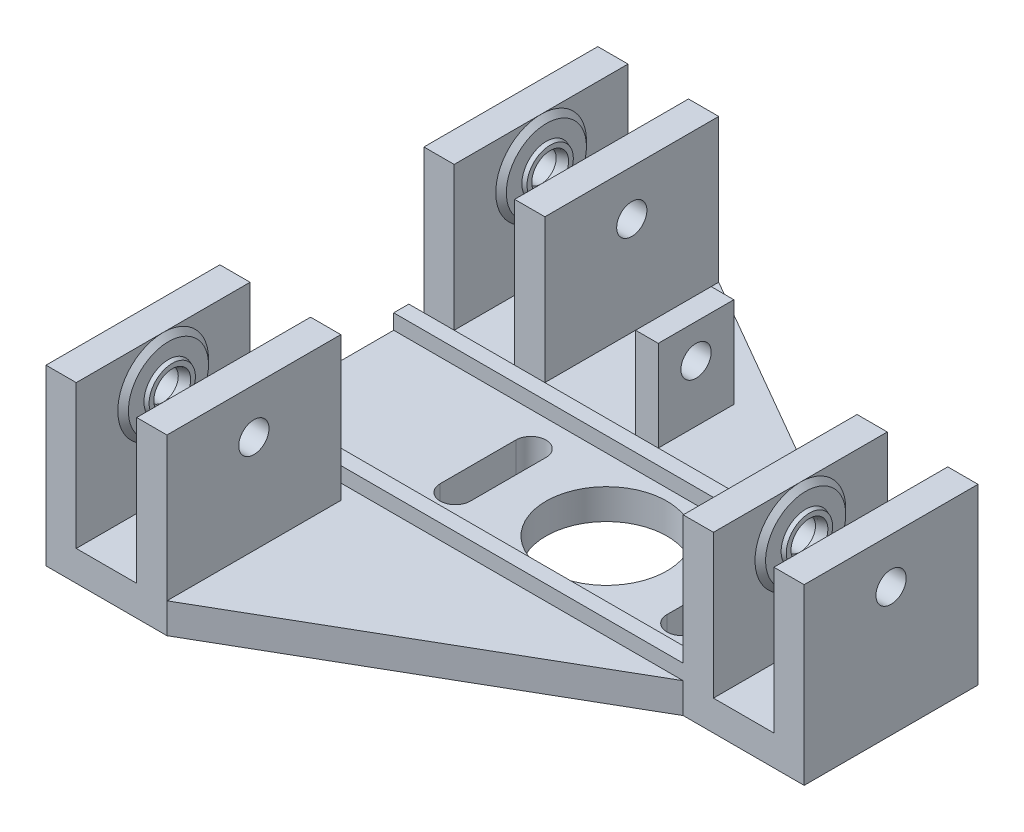
from build123d import *

# Parameters (mm, degrees)
SKETCH1_R                     = 8
BOSS_EXTRUDE1_DEPTH           = 4
SKETCH2_W                     = 4
SKETCH2_H                     = 23
BOSS_EXTRUDE2_DEPTH           = 19
SKETCH3_R                     = 2
CUT_EXTRUDE1_DEPTH            = 87.784395441
SKETCH4_R                     = 6
SKETCH4_R_2                   = 2
BOSS_EXTRUDE3_DEPTH           = 0.7
BOSS_EXTRUDE3_DRAFT           = 45
BOSS_EXTRUDE3_PROFILE_2_DEPTH = 0.7
BOSS_EXTRUDE3_PROFILE_2_DRAFT = 45
SKETCH5_R                     = 3.5
SKETCH5_R_2                   = 2
BOSS_EXTRUDE4_DEPTH           = 1.2
BOSS_EXTRUDE4_DRAFT           = 20
BOSS_EXTRUDE4_PROFILE_2_DEPTH = 1.2
BOSS_EXTRUDE4_PROFILE_2_DRAFT = 20
SKETCH6_R                     = 6
SKETCH6_R_2                   = 2
BOSS_EXTRUDE5_DEPTH           = 0.7
BOSS_EXTRUDE5_DRAFT           = 45
BOSS_EXTRUDE5_PROFILE_2_DEPTH = 0.7
BOSS_EXTRUDE5_PROFILE_2_DRAFT = 45
SKETCH7_R                     = 3.5
SKETCH7_R_2                   = 2
BOSS_EXTRUDE6_DEPTH           = 1.2
BOSS_EXTRUDE6_DRAFT           = 20
BOSS_EXTRUDE6_PROFILE_2_DEPTH = 1.2
BOSS_EXTRUDE6_PROFILE_2_DRAFT = 20
SKETCH8_R                     = 6
SKETCH8_R_2                   = 2
BOSS_EXTRUDE7_DEPTH           = 0.7
BOSS_EXTRUDE7_DRAFT           = 45
SKETCH9_R                     = 3.5
SKETCH9_R_2                   = 2
BOSS_EXTRUDE8_DEPTH           = 1.2
BOSS_EXTRUDE8_DRAFT           = 20
SKETCH11_R                    = 6
SKETCH11_R_2                  = 2
BOSS_EXTRUDE9_DEPTH           = 0.7
BOSS_EXTRUDE9_DRAFT           = 45
SKETCH12_R                    = 3.5
SKETCH12_R_2                  = 2
BOSS_EXTRUDE10_DEPTH          = 1.2
BOSS_EXTRUDE10_DRAFT          = 20
SKETCH13_W                    = 59.30127019
SKETCH13_H                    = 2
BOSS_EXTRUDE11_DEPTH          = 2
SKETCH14_W                    = 3
SKETCH14_H                    = 10
BOSS_EXTRUDE12_DEPTH          = 12
CUT_EXTRUDE2_REACH            = 63.837
SKETCH15_R                    = 2


with BuildPart() as part:
    # Sketch1 → Boss-Extrude1 (new body)
    with BuildSketch(Plane(origin=(0, 0, 0), x_dir=(1, 0, 0), z_dir=(0, 1, 0))):
        Polygon((-21.650635095, 36.5), (-37.650635095, 36.5), (-37.650635095, -36.5), (-21.650635095, -36.5), (21.650635095, -11.5), (37.650635095, -11.5), (37.650635095, 11.5), (21.650635095, 11.5), align=None)
        with BuildLine():
            ThreePointArc((-13, -5), (-15, -7), (-17, -5))
            Line((-17, -5), (-17, 5))
            ThreePointArc((-17, 5), (-15, 7), (-13, 5))
            Line((-13, 5), (-13, -5))
        make_face(mode=Mode.SUBTRACT)
        with Locations(Location((0, 0, 0), (0, 0, 270))):
            Circle(SKETCH1_R, mode=Mode.SUBTRACT)
        with BuildLine():
            ThreePointArc((17, -5), (15, -7), (13, -5))
            Line((13, -5), (13, 5))
            ThreePointArc((13, 5), (15, 7), (17, 5))
            Line((17, 5), (17, -5))
        make_face(mode=Mode.SUBTRACT)
    extrude(amount=BOSS_EXTRUDE1_DEPTH)

    # Sketch2 → Boss-Extrude2 (add)
    with BuildSketch(Plane(origin=(0, 4, 0), x_dir=(1, 0, 0), z_dir=(0, 1, 0))):
        with Locations((35.650635095, 0)):
            Rectangle(SKETCH2_W, SKETCH2_H)
        with Locations((23.650635095, 0)):
            Rectangle(SKETCH2_W, SKETCH2_H)
        with Locations((-35.650635095, 25)):
            Rectangle(SKETCH2_W, SKETCH2_H)
        with Locations((-23.650635095, 25)):
            Rectangle(SKETCH2_W, SKETCH2_H)
        with Locations((-35.650635095, -25)):
            Rectangle(SKETCH2_W, SKETCH2_H)
        with Locations((-23.650635095, -25)):
            Rectangle(SKETCH2_W, SKETCH2_H)
    extrude(amount=BOSS_EXTRUDE2_DEPTH)

    # Sketch3 → Cut-Extrude1 (cut, through all)
    with BuildSketch(Plane.ZY.offset(37.650635095)):
        with Locations((-25, 17)):
            Circle(SKETCH3_R)
        with Locations((0, 17)):
            Circle(SKETCH3_R)
        with Locations((25, 17)):
            Circle(SKETCH3_R)
    extrude(amount=-CUT_EXTRUDE1_DEPTH, mode=Mode.SUBTRACT)


with BuildPart() as boss_extrude3_tool:
    # Sketch4 → Boss-Extrude3 (with draft: the straight prism first)
    with BuildSketch(Plane.ZY.offset(25.650635095)):
        with Locations((-25, 17)):
            Circle(SKETCH4_R)
        with Locations((-25, 17)):
            Circle(SKETCH4_R_2, mode=Mode.SUBTRACT)
    extrude(amount=BOSS_EXTRUDE3_DEPTH)
    # Boss-Extrude3: the draft: its side faces are tilted about the plane it starts from
    boss_extrude3_sides = [boss_extrude3_tool.faces().sort_by_distance(p)[0] for p in [
        (-26.000635095, 17, -31),
        (-26.000635095, 17, -27),
    ]]
    draft(boss_extrude3_sides, Plane.ZY.offset(25.650635095), BOSS_EXTRUDE3_DRAFT)


with BuildPart() as part_1:
    add(part.part)

    # Boss-Extrude3: add boss_extrude3_tool
    add(boss_extrude3_tool.part)


with BuildPart() as boss_extrude3_profile_2_tool:
    # Sketch4 → Boss-Extrude3 profile 2 (with draft: the straight prism first)
    with BuildSketch(Plane.ZY.offset(25.650635095)):
        with Locations((25, 17)):
            Circle(SKETCH4_R)
        with Locations((25, 17)):
            Circle(SKETCH4_R_2, mode=Mode.SUBTRACT)
    extrude(amount=BOSS_EXTRUDE3_PROFILE_2_DEPTH)
    # Boss-Extrude3 profile 2: the draft: its side faces are tilted about the plane it starts from
    boss_extrude3_profile_2_sides = [boss_extrude3_profile_2_tool.faces().sort_by_distance(p)[0] for p in [
        (-26.000635095, 17, 19),
        (-26.000635095, 17, 23),
    ]]
    draft(boss_extrude3_profile_2_sides, Plane.ZY.offset(25.650635095), BOSS_EXTRUDE3_PROFILE_2_DRAFT)


with BuildPart() as part_2:
    add(part_1.part)

    # Boss-Extrude3 profile 2: add boss_extrude3_profile_2_tool
    add(boss_extrude3_profile_2_tool.part)


with BuildPart() as boss_extrude4_tool:
    # Sketch5 → Boss-Extrude4 (with draft: the straight prism first)
    with BuildSketch(Plane.ZY.offset(25.650635095)):
        with Locations((-25, 17)):
            Circle(SKETCH5_R)
        with Locations((-25, 17)):
            Circle(SKETCH5_R_2, mode=Mode.SUBTRACT)
    extrude(amount=BOSS_EXTRUDE4_DEPTH)
    # Boss-Extrude4: the draft: its side faces are tilted about the plane it starts from
    boss_extrude4_sides = [boss_extrude4_tool.faces().sort_by_distance(p)[0] for p in [
        (-26.250635095, 17, -28.5),
        (-26.250635095, 17, -27),
    ]]
    draft(boss_extrude4_sides, Plane.ZY.offset(25.650635095), BOSS_EXTRUDE4_DRAFT)


with BuildPart() as part_3:
    add(part_2.part)

    # Boss-Extrude4: add boss_extrude4_tool
    add(boss_extrude4_tool.part)


with BuildPart() as boss_extrude4_profile_2_tool:
    # Sketch5 → Boss-Extrude4 profile 2 (with draft: the straight prism first)
    with BuildSketch(Plane.ZY.offset(25.650635095)):
        with Locations((25, 17)):
            Circle(SKETCH5_R)
        with Locations((25, 17)):
            Circle(SKETCH5_R_2, mode=Mode.SUBTRACT)
    extrude(amount=BOSS_EXTRUDE4_PROFILE_2_DEPTH)
    # Boss-Extrude4 profile 2: the draft: its side faces are tilted about the plane it starts from
    boss_extrude4_profile_2_sides = [boss_extrude4_profile_2_tool.faces().sort_by_distance(p)[0] for p in [
        (-26.250635095, 17, 21.5),
        (-26.250635095, 17, 23),
    ]]
    draft(boss_extrude4_profile_2_sides, Plane.ZY.offset(25.650635095), BOSS_EXTRUDE4_PROFILE_2_DRAFT)


with BuildPart() as part_4:
    add(part_3.part)

    # Boss-Extrude4 profile 2: add boss_extrude4_profile_2_tool
    add(boss_extrude4_profile_2_tool.part)


with BuildPart() as boss_extrude5_tool:
    # Sketch6 → Boss-Extrude5 (with draft: the straight prism first)
    with BuildSketch(Plane(origin=(-33.650635095, 0, 0), x_dir=(0, 0, -1), z_dir=(1, 0, 0))):
        with Locations((-25, 17)):
            Circle(SKETCH6_R)
        with Locations(Location((-25, 17, 0), (0, 0, 180))):
            Circle(SKETCH6_R_2, mode=Mode.SUBTRACT)
    extrude(amount=BOSS_EXTRUDE5_DEPTH)
    # Boss-Extrude5: the draft: its side faces are tilted about the plane it starts from
    boss_extrude5_sides = [boss_extrude5_tool.faces().sort_by_distance(p)[0] for p in [
        (-33.300635095, 17, 31),
        (-33.300635095, 17, 23),
    ]]
    draft(boss_extrude5_sides, Plane(origin=(-33.650635095, 0, 0), x_dir=(0, 0, -1), z_dir=(1, 0, 0)), BOSS_EXTRUDE5_DRAFT)


with BuildPart() as part_5:
    add(part_4.part)

    # Boss-Extrude5: add boss_extrude5_tool
    add(boss_extrude5_tool.part)


with BuildPart() as boss_extrude5_profile_2_tool:
    # Sketch6 → Boss-Extrude5 profile 2 (with draft: the straight prism first)
    with BuildSketch(Plane(origin=(-33.650635095, 0, 0), x_dir=(0, 0, -1), z_dir=(1, 0, 0))):
        with Locations((25, 17)):
            Circle(SKETCH6_R)
        with Locations(Location((25, 17, 0), (0, 0, 180))):
            Circle(SKETCH6_R_2, mode=Mode.SUBTRACT)
    extrude(amount=BOSS_EXTRUDE5_PROFILE_2_DEPTH)
    # Boss-Extrude5 profile 2: the draft: its side faces are tilted about the plane it starts from
    boss_extrude5_profile_2_sides = [boss_extrude5_profile_2_tool.faces().sort_by_distance(p)[0] for p in [
        (-33.300635095, 17, -19),
        (-33.300635095, 17, -27),
    ]]
    draft(boss_extrude5_profile_2_sides, Plane(origin=(-33.650635095, 0, 0), x_dir=(0, 0, -1), z_dir=(1, 0, 0)), BOSS_EXTRUDE5_PROFILE_2_DRAFT)


with BuildPart() as part_6:
    add(part_5.part)

    # Boss-Extrude5 profile 2: add boss_extrude5_profile_2_tool
    add(boss_extrude5_profile_2_tool.part)


with BuildPart() as boss_extrude6_tool:
    # Sketch7 → Boss-Extrude6 (with draft: the straight prism first)
    with BuildSketch(Plane(origin=(-33.650635095, 0, 0), x_dir=(0, 0, -1), z_dir=(1, 0, 0))):
        with Locations((-25, 17)):
            Circle(SKETCH7_R)
        with Locations(Location((-25, 17, 0), (0, 0, 180))):
            Circle(SKETCH7_R_2, mode=Mode.SUBTRACT)
    extrude(amount=BOSS_EXTRUDE6_DEPTH)
    # Boss-Extrude6: the draft: its side faces are tilted about the plane it starts from
    boss_extrude6_sides = [boss_extrude6_tool.faces().sort_by_distance(p)[0] for p in [
        (-33.050635095, 17, 28.5),
        (-33.050635095, 17, 23),
    ]]
    draft(boss_extrude6_sides, Plane(origin=(-33.650635095, 0, 0), x_dir=(0, 0, -1), z_dir=(1, 0, 0)), BOSS_EXTRUDE6_DRAFT)


with BuildPart() as part_7:
    add(part_6.part)

    # Boss-Extrude6: add boss_extrude6_tool
    add(boss_extrude6_tool.part)


with BuildPart() as boss_extrude6_profile_2_tool:
    # Sketch7 → Boss-Extrude6 profile 2 (with draft: the straight prism first)
    with BuildSketch(Plane(origin=(-33.650635095, 0, 0), x_dir=(0, 0, -1), z_dir=(1, 0, 0))):
        with Locations((25, 17)):
            Circle(SKETCH7_R)
        with Locations(Location((25, 17, 0), (0, 0, 180))):
            Circle(SKETCH7_R_2, mode=Mode.SUBTRACT)
    extrude(amount=BOSS_EXTRUDE6_PROFILE_2_DEPTH)
    # Boss-Extrude6 profile 2: the draft: its side faces are tilted about the plane it starts from
    boss_extrude6_profile_2_sides = [boss_extrude6_profile_2_tool.faces().sort_by_distance(p)[0] for p in [
        (-33.050635095, 17, -21.5),
        (-33.050635095, 17, -27),
    ]]
    draft(boss_extrude6_profile_2_sides, Plane(origin=(-33.650635095, 0, 0), x_dir=(0, 0, -1), z_dir=(1, 0, 0)), BOSS_EXTRUDE6_PROFILE_2_DRAFT)


with BuildPart() as part_8:
    add(part_7.part)

    # Boss-Extrude6 profile 2: add boss_extrude6_profile_2_tool
    add(boss_extrude6_profile_2_tool.part)


with BuildPart() as boss_extrude7_tool:
    # Sketch8 → Boss-Extrude7 (with draft: the straight prism first)
    with BuildSketch(Plane(origin=(25.650635095, 0, 0), x_dir=(0, 0, -1), z_dir=(1, 0, 0))):
        with Locations((0, 17)):
            Circle(SKETCH8_R)
        with Locations(Location((0, 17, 0), (0, 0, 180))):
            Circle(SKETCH8_R_2, mode=Mode.SUBTRACT)
    extrude(amount=BOSS_EXTRUDE7_DEPTH)
    # Boss-Extrude7: the draft: its side faces are tilted about the plane it starts from
    boss_extrude7_sides = [boss_extrude7_tool.faces().sort_by_distance(p)[0] for p in [
        (26.000635095, 17, 6),
        (26.000635095, 17, -2),
    ]]
    draft(boss_extrude7_sides, Plane(origin=(25.650635095, 0, 0), x_dir=(0, 0, -1), z_dir=(1, 0, 0)), BOSS_EXTRUDE7_DRAFT)


with BuildPart() as part_9:
    add(part_8.part)

    # Boss-Extrude7: add boss_extrude7_tool
    add(boss_extrude7_tool.part)


with BuildPart() as boss_extrude8_tool:
    # Sketch9 → Boss-Extrude8 (with draft: the straight prism first)
    with BuildSketch(Plane(origin=(25.650635095, 0, 0), x_dir=(0, 0, -1), z_dir=(1, 0, 0))):
        with Locations((0, 17)):
            Circle(SKETCH9_R)
        with Locations(Location((0, 17, 0), (0, 0, 180))):
            Circle(SKETCH9_R_2, mode=Mode.SUBTRACT)
    extrude(amount=BOSS_EXTRUDE8_DEPTH)
    # Boss-Extrude8: the draft: its side faces are tilted about the plane it starts from
    boss_extrude8_sides = [boss_extrude8_tool.faces().sort_by_distance(p)[0] for p in [
        (26.250635095, 17, 3.5),
        (26.250635095, 17, -2),
    ]]
    draft(boss_extrude8_sides, Plane(origin=(25.650635095, 0, 0), x_dir=(0, 0, -1), z_dir=(1, 0, 0)), BOSS_EXTRUDE8_DRAFT)


with BuildPart() as part_10:
    add(part_9.part)

    # Boss-Extrude8: add boss_extrude8_tool
    add(boss_extrude8_tool.part)


with BuildPart() as boss_extrude9_tool:
    # Sketch11 → Boss-Extrude9 (with draft: the straight prism first)
    with BuildSketch(Plane.ZY.offset(-33.650635095)):
        with Locations((0, 17)):
            Circle(SKETCH11_R)
        with Locations((0, 17)):
            Circle(SKETCH11_R_2, mode=Mode.SUBTRACT)
    extrude(amount=BOSS_EXTRUDE9_DEPTH)
    # Boss-Extrude9: the draft: its side faces are tilted about the plane it starts from
    boss_extrude9_sides = [boss_extrude9_tool.faces().sort_by_distance(p)[0] for p in [
        (33.300635095, 17, -6),
        (33.300635095, 17, -2),
    ]]
    draft(boss_extrude9_sides, Plane.ZY.offset(-33.650635095), BOSS_EXTRUDE9_DRAFT)


with BuildPart() as part_11:
    add(part_10.part)

    # Boss-Extrude9: add boss_extrude9_tool
    add(boss_extrude9_tool.part)


with BuildPart() as boss_extrude10_tool:
    # Sketch12 → Boss-Extrude10 (with draft: the straight prism first)
    with BuildSketch(Plane.ZY.offset(-33.650635095)):
        with Locations((0, 17)):
            Circle(SKETCH12_R)
        with Locations((0, 17)):
            Circle(SKETCH12_R_2, mode=Mode.SUBTRACT)
    extrude(amount=BOSS_EXTRUDE10_DEPTH)
    # Boss-Extrude10: the draft: its side faces are tilted about the plane it starts from
    boss_extrude10_sides = [boss_extrude10_tool.faces().sort_by_distance(p)[0] for p in [
        (33.050635095, 17, -3.5),
        (33.050635095, 17, -2),
    ]]
    draft(boss_extrude10_sides, Plane.ZY.offset(-33.650635095), BOSS_EXTRUDE10_DRAFT)


with BuildPart() as part_12:
    add(part_11.part)

    # Boss-Extrude10: add boss_extrude10_tool
    add(boss_extrude10_tool.part)

    # Sketch13 → Boss-Extrude11 (add)
    with BuildSketch(Plane(origin=(0, 4, 0), x_dir=(1, 0, 0), z_dir=(0, 1, 0))):
        with Locations((-8, 10.5)):
            Rectangle(SKETCH13_W, SKETCH13_H)
        with Locations((-8, -10.5)):
            Rectangle(SKETCH13_W, SKETCH13_H)
    extrude(amount=BOSS_EXTRUDE11_DEPTH)

    # Sketch14 → Boss-Extrude12 (add)
    with BuildSketch(Plane(origin=(0, 4, 0), x_dir=(1, 0, 0), z_dir=(0, 1, 0))):
        with Locations((-8.150635095, 18.5)):
            Rectangle(SKETCH14_W, SKETCH14_H)
    extrude(amount=BOSS_EXTRUDE12_DEPTH)

    # Sketch15 → Cut-Extrude2 (cut, up to next)
    with BuildSketch(Plane(origin=(-6.650635095, 0, 0), x_dir=(0, 0, -1), z_dir=(1, 0, 0)), mode=Mode.PRIVATE) as cut_extrude2_sk1:
        with Locations((18.5, 11.5)):
            Circle(SKETCH15_R)
    cut_extrude2_tool1 = extrude(cut_extrude2_sk1.sketch, amount=-CUT_EXTRUDE2_REACH, mode=Mode.PRIVATE) & part_12.part
    add(cut_extrude2_tool1.solids().sort_by_distance((-6.650635, 11.5, -18.5))[0], mode=Mode.SUBTRACT)


solid = part_12.part
